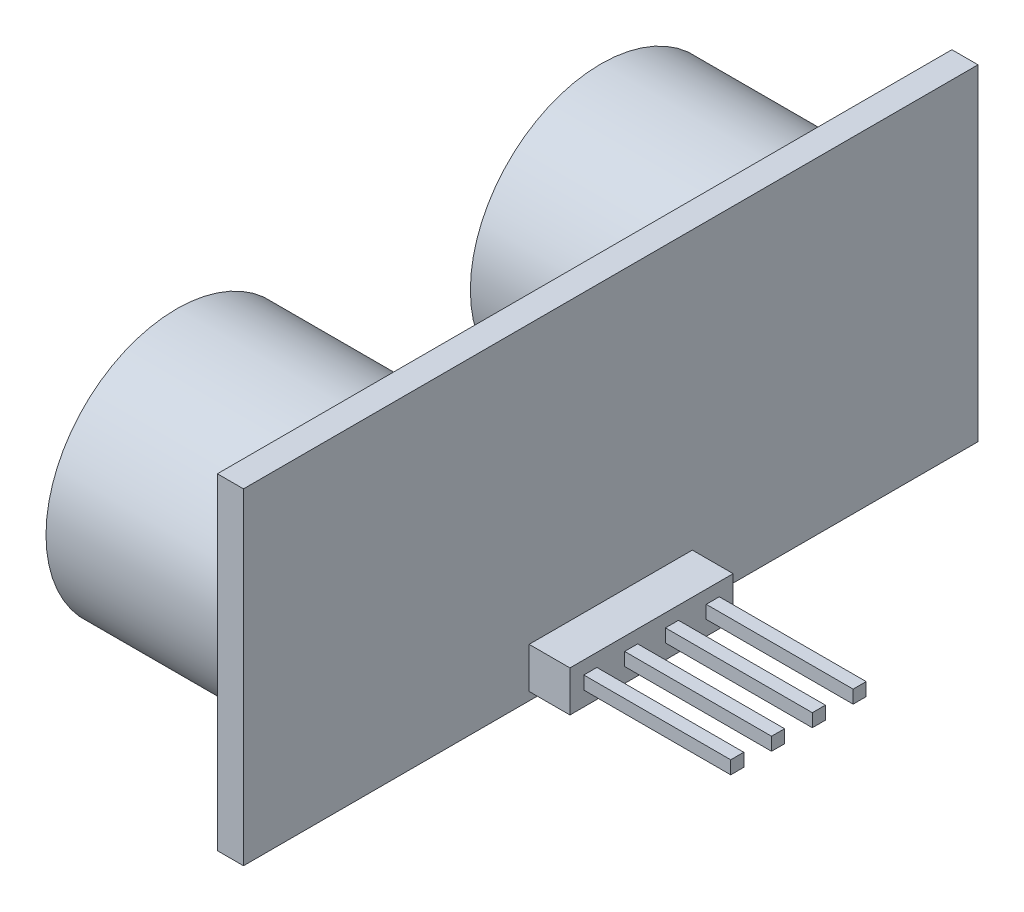
from build123d import *

# Parameters (mm, degrees)
SKETCH1_W           = 1.6
SKETCH1_H           = 20
BOSS_EXTRUDE1_DEPTH = 45
SKETCH2_W           = 10
SKETCH2_H           = 2.5
BOSS_EXTRUDE2_DEPTH = 2.5
SKETCH3_W           = 0.8
SKETCH3_H           = 0.8
BOSS_EXTRUDE3_DEPTH = 9
SKETCH4_R           = 8
BOSS_EXTRUDE4_DEPTH = 12
SKETCH5_R           = 7
CUT_EXTRUDE1_DEPTH  = 1


with BuildPart() as part:
    # Sketch1 → Boss-Extrude1 (new body)
    with BuildSketch(Plane.XY):
        Rectangle(SKETCH1_W, SKETCH1_H)
    extrude(amount=BOSS_EXTRUDE1_DEPTH)

    # Sketch2 → Boss-Extrude2 (add)
    with BuildSketch(Plane(origin=(0.8, 0, 0), x_dir=(0, 0, -1), z_dir=(1, 0, 0))):
        with Locations((-22.5, -8.25)):
            Rectangle(SKETCH2_W, SKETCH2_H)
    extrude(amount=BOSS_EXTRUDE2_DEPTH)

    # Sketch3 → Boss-Extrude3 (add)
    with BuildSketch(Plane(origin=(3.3, -6.2, 0), x_dir=(0, -1, 0), z_dir=(-1, 0, 0))):
        with Locations((2.000946282, 26.25)):
            Rectangle(SKETCH3_W, SKETCH3_H)
        with Locations((2.000946282, 23.75)):
            Rectangle(SKETCH3_W, SKETCH3_H)
        with Locations((2.000946282, 21.25)):
            Rectangle(SKETCH3_W, SKETCH3_H)
        with Locations((2.000946282, 18.75)):
            Rectangle(SKETCH3_W, SKETCH3_H)
    extrude(amount=-BOSS_EXTRUDE3_DEPTH)

    # Sketch4 → Boss-Extrude4 (add)
    with BuildSketch(Plane.ZY.offset(0.8)):
        with Locations(Location((9.5, 0, 0), (0, 0, 180))):
            Circle(SKETCH4_R)
        with Locations(Location((35.5, 0, 0), (0, 0, 180))):
            Circle(SKETCH4_R)
    extrude(amount=BOSS_EXTRUDE4_DEPTH)

    # Sketch5 → Cut-Extrude1 (cut)
    with BuildSketch(Plane.ZY.offset(12.8)):
        with Locations((35.5, 0)):
            Circle(SKETCH5_R)
        with Locations((9.5, 0)):
            Circle(SKETCH5_R)
    extrude(amount=-CUT_EXTRUDE1_DEPTH, mode=Mode.SUBTRACT)


solid = part.part
